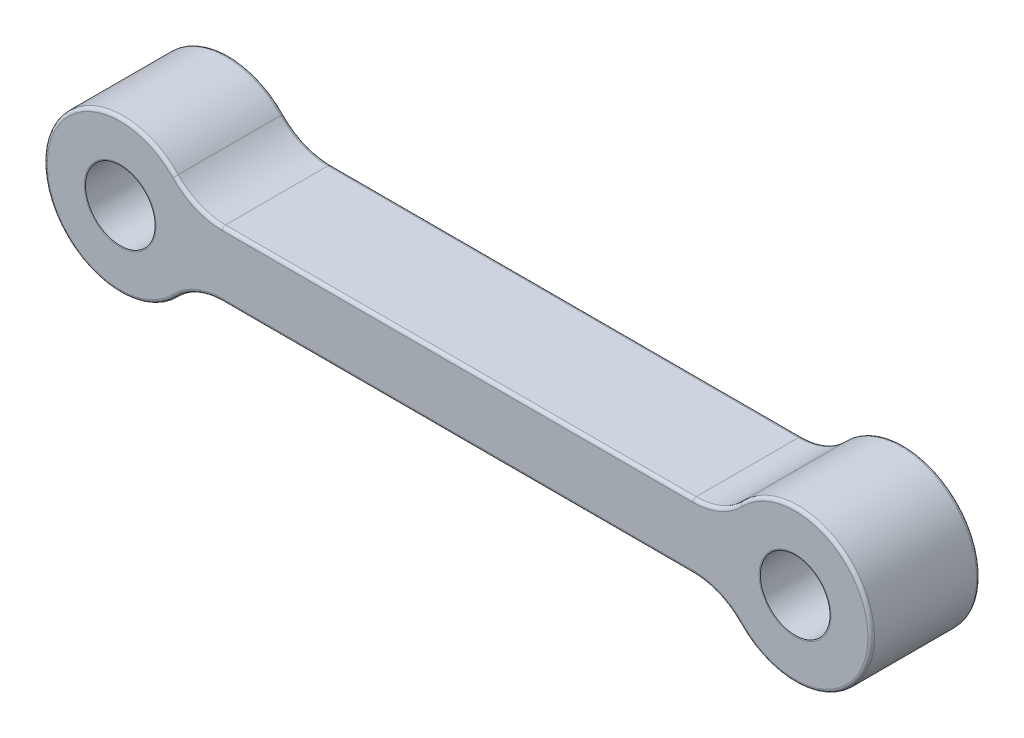
from build123d import *

# Parameters (mm, degrees)
SKETCH1_R            = 3.5
SKETCH1_R_2          = 1.5
BOSS_EXTRUDE1_DEPTH  = 2.5
FILLET1_R            = 3
FILLET2_R            = 0.15
M3_CLEARANCE_HOLE1_D = 3.2


with BuildPart() as part:
    # Sketch1 → Boss-Extrude1 (new, symmetric)
    # profile 1 of 3: a face of its own
    with BuildSketch(Plane.XY):
        Circle(SKETCH1_R)
        Circle(SKETCH1_R_2, mode=Mode.SUBTRACT)
    # profile 2 of 3: a face of its own
    with BuildSketch(Plane.XY):
        with BuildLine():
            Line((3.16227766, -1.5), (27.83772234, -1.5))
            ThreePointArc((27.83772234, -1.5), (27.5, 0), (27.83772234, 1.5))
            Line((27.83772234, 1.5), (3.16227766, 1.5))
            ThreePointArc((3.16227766, 1.5), (3.414525722, 0.768774411), (3.5, 0))
            ThreePointArc((3.5, 0), (3.414525722, -0.768774411), (3.16227766, -1.5))
        make_face()
    # profile 3 of 3: a face of its own
    with BuildSketch(Plane.XY):
        with Locations((31, 0)):
            Circle(SKETCH1_R)
        with Locations((31, 0)):
            Circle(SKETCH1_R_2, mode=Mode.SUBTRACT)
    extrude(amount=BOSS_EXTRUDE1_DEPTH, both=True)

    # Fillet1
    fillet1_edges = [part.edges().sort_by_distance(p)[0] for p in [
        (27.83772234, 1.5, 0),
        (27.83772234, -1.5, 0),
        (3.16227766, -1.5, 0),
        (3.16227766, 1.5, 0),
    ]]
    fillet(fillet1_edges, radius=FILLET1_R)

    # Fillet2
    fillet2_edges = [part.edges().sort_by_distance(p)[0] for p in [
        (-3.5, 0, -2.5),
        (-3.5, 0, 2.5),
        (-1.5, 0, 2.5),
        (15.5, 1.5, -2.5),
        (15.5, 1.5, 2.5),
        (34.5, 0, -2.5),
        (34.5, 0, 2.5),
        (29.5, 0, 2.5),
        (15.5, -1.5, -2.5),
        (15.5, -1.5, 2.5),
        (3.513718949, 1.740401367, -2.5),
        (3.513718949, 1.740401367, 2.5),
        (27.486281051, 1.740401367, -2.5),
        (27.486281051, 1.740401367, 2.5),
        (3.513718949, -1.740401367, -2.5),
        (3.513718949, -1.740401367, 2.5),
        (27.486281051, -1.740401367, -2.5),
        (27.486281051, -1.740401367, 2.5),
        (29.5, 0, -2.5),
        (-1.5, 0, -2.5),
    ]]
    fillet(fillet2_edges, radius=FILLET2_R)

    # M3 Clearance Hole1 (through all)
    with Locations(Plane(origin=(0, 0, -2.5), x_dir=(-1, 0, 0), z_dir=(0, 0, -1))):
        with Locations((-31, 0), (0, 0)):
            Hole(M3_CLEARANCE_HOLE1_D / 2)


solid = part.part
